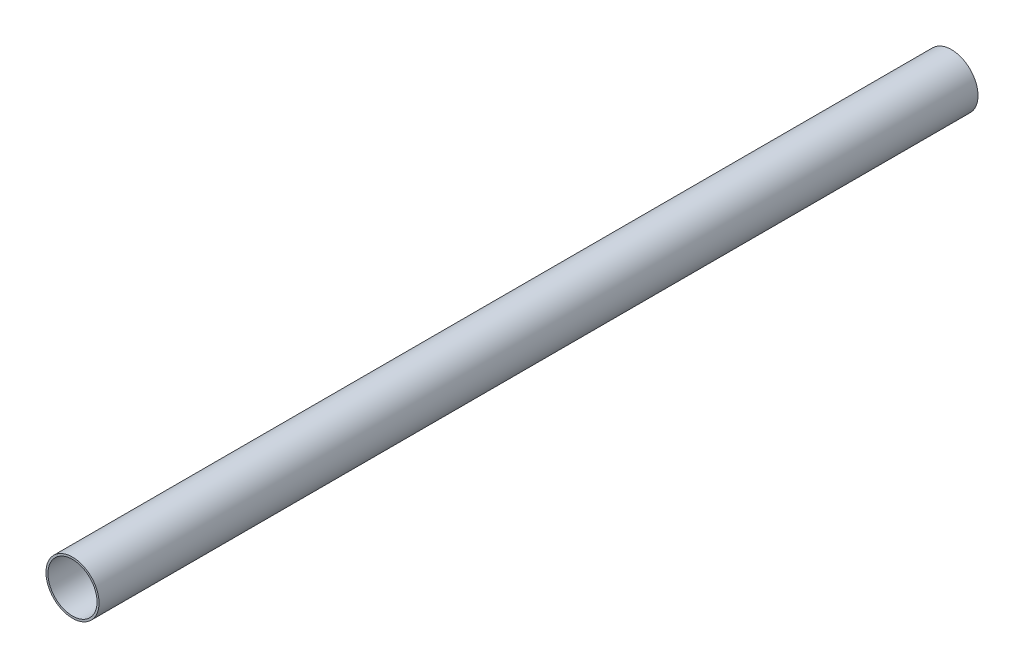
from build123d import *

# Parameters (mm, degrees)
SKETCH1_R           = 8
SKETCH1_R_2         = 7.4
BOSS_EXTRUDE1_DEPTH = 265


with BuildPart() as part:
    # Sketch1 → Boss-Extrude1 (new body)
    with BuildSketch(Plane.XY):
        Circle(SKETCH1_R)
        Circle(SKETCH1_R_2, mode=Mode.SUBTRACT)
    extrude(amount=BOSS_EXTRUDE1_DEPTH)


solid = part.part
